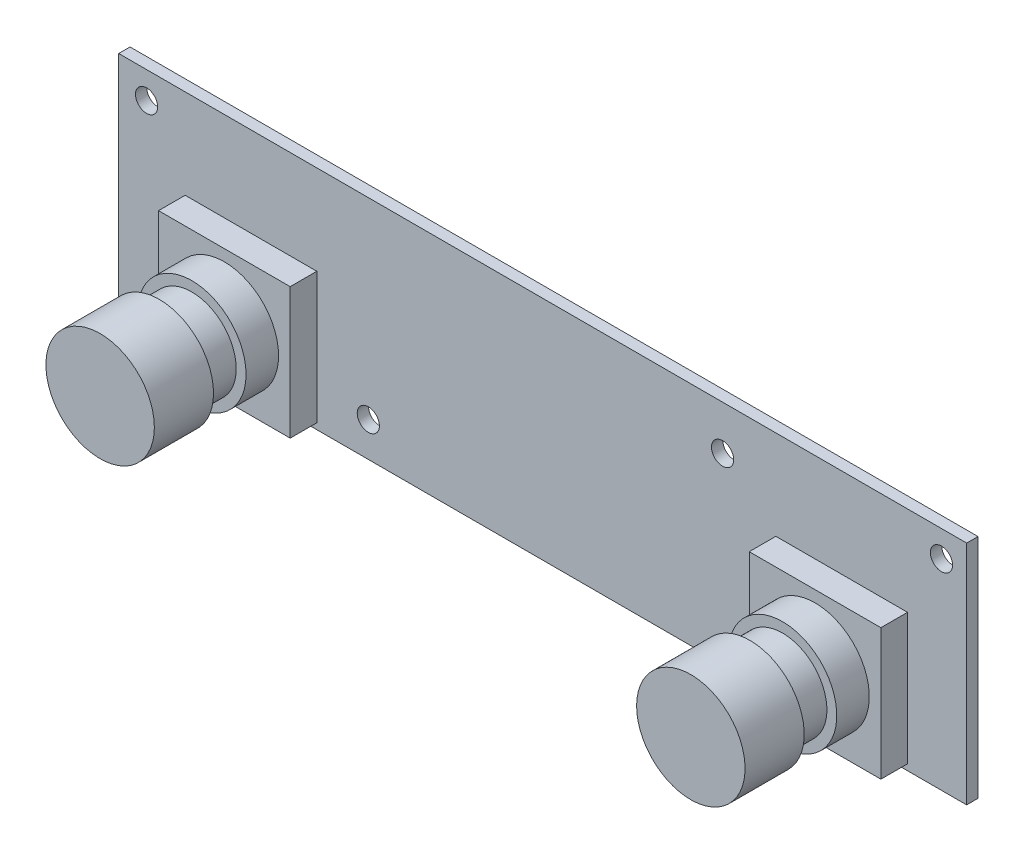
from build123d import *

# Parameters (mm, degrees)
SKETCH1_W           = 86
SKETCH1_H           = 23
BOSS_EXTRUDE1_DEPTH = 1.15
SKETCH2_W           = 13.35
SKETCH2_H           = 13.31
BOSS_EXTRUDE2_DEPTH = 2.7
SKETCH3_R           = 5.5
BOSS_EXTRUDE3_DEPTH = 3.3
SKETCH5_R           = 4.5
BOSS_EXTRUDE4_DEPTH = 3.3
SKETCH6_R           = 5.5
BOSS_EXTRUDE5_DEPTH = 6
SKETCH7_R           = 1.125
CUT_EXTRUDE1_DEPTH  = 3


with BuildPart() as part:
    # Sketch1 → Boss-Extrude1 (new body)
    with BuildSketch(Plane.XY):
        Rectangle(SKETCH1_W, SKETCH1_H)
    extrude(amount=-BOSS_EXTRUDE1_DEPTH)

    # Sketch2 → Boss-Extrude2 (add)
    with BuildSketch(Plane.XY):
        with Locations((-29.585, -4.237161914)):
            Rectangle(SKETCH2_W, SKETCH2_H)
        with Locations((30.325, -4.237161914)):
            Rectangle(SKETCH2_W, SKETCH2_H)
    extrude(amount=BOSS_EXTRUDE2_DEPTH)

    # Sketch3 → Boss-Extrude3 (add)
    with BuildSketch(Plane.XY.offset(2.7)):
        with Locations((-29.585, -4.237161914)):
            Circle(SKETCH3_R)
    boss_extrude3 = extrude(amount=BOSS_EXTRUDE3_DEPTH)

    # Sketch5 → Boss-Extrude4 (add)
    with BuildSketch(Plane.XY.offset(6)):
        with Locations((-29.585, -4.237161914)):
            Circle(SKETCH5_R)
    boss_extrude4 = extrude(amount=BOSS_EXTRUDE4_DEPTH)

    # Sketch6 → Boss-Extrude5 (add)
    with BuildSketch(Plane.XY.offset(9.3)):
        with Locations((-29.585, -4.237161914)):
            Circle(SKETCH6_R)
    boss_extrude5 = extrude(amount=BOSS_EXTRUDE5_DEPTH)

    # Mirror1: Boss-Extrude3, Boss-Extrude4, Boss-Extrude5 across plane
    add(boss_extrude3.mirror(Plane(origin=(0.37, 0, 0), x_dir=(0, 0, 1), z_dir=(1, 0, 0))))
    add(boss_extrude4.mirror(Plane(origin=(0.37, 0, 0), x_dir=(0, 0, 1), z_dir=(1, 0, 0))))
    add(boss_extrude5.mirror(Plane(origin=(0.37, 0, 0), x_dir=(0, 0, 1), z_dir=(1, 0, 0))))

    # Sketch7 → Cut-Extrude1 (cut)
    with BuildSketch(Plane(origin=(0, 0, -1.15), x_dir=(-1, 0, 0), z_dir=(0, 0, -1))):
        with Locations((40.175, 8.775)):
            Circle(SKETCH7_R)
        with Locations((17.685, -7.995)):
            Circle(SKETCH7_R)
        with Locations((-18.245, 6.995)):
            Circle(SKETCH7_R)
        with Locations((-40.445, 8.835764466)):
            Circle(SKETCH7_R)
    extrude(amount=-CUT_EXTRUDE1_DEPTH, mode=Mode.SUBTRACT)


solid = part.part
